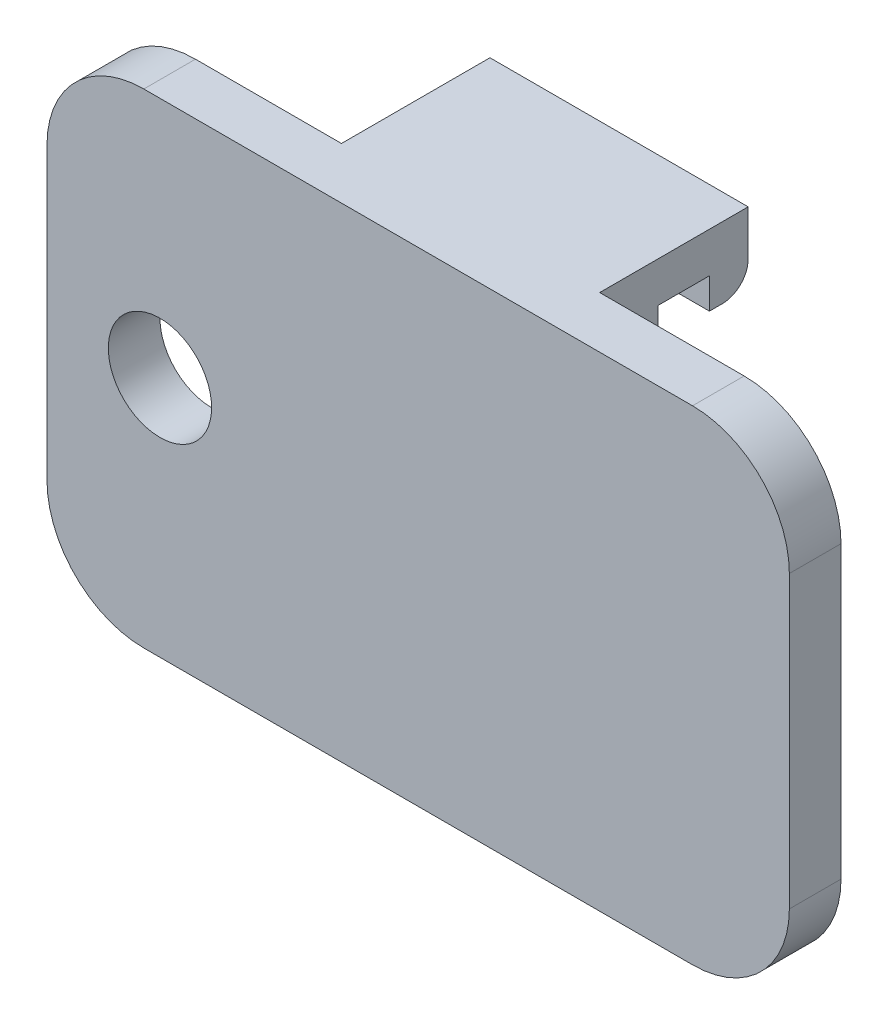
from build123d import *

# Parameters (mm, degrees)
SKETCH_1_W      = 23
SKETCH_1_H      = 15
SKETCH_1_R      = 1.6
EXTRUDE_1_DEPTH = 1.6
SKETCH_2_W      = 8
SKETCH_2_H      = 4
EXTRUDE_2_DEPTH = 1.8
SKETCH_4_W      = 8
SKETCH_4_H      = 1.25
EXTRUDE_3_DEPTH = 1.6
SKETCH_5_W      = 8
SKETCH_5_H      = 2.2
EXTRUDE_4_DEPTH = 1.2
FILLET_1_R      = 0.8
FILLET_2_R      = 3


with BuildPart() as part:
    # 草图1 → 凸台-拉伸1 (new body)
    with BuildSketch(Plane.XY):
        Rectangle(SKETCH_1_W, SKETCH_1_H)
        with Locations((-8, 0)):
            Circle(SKETCH_1_R, mode=Mode.SUBTRACT)
    extrude(amount=EXTRUDE_1_DEPTH)

    # 草图2 → 凸台-拉伸2 (add)
    with BuildSketch(Plane(origin=(0, 0, 0), x_dir=(-1, 0, 0), z_dir=(0, 0, -1))):
        with Locations((-0.023575702, 5.5)):
            Rectangle(SKETCH_2_W, SKETCH_2_H)
        with Locations((-0.023575702, -5.5)):
            Rectangle(SKETCH_2_W, SKETCH_2_H)
    extrude(amount=EXTRUDE_2_DEPTH)

    # 草图4 → 凸台-拉伸3 (add)
    with BuildSketch(Plane(origin=(0, 0, -1.8), x_dir=(-1, 0, 0), z_dir=(0, 0, -1))):
        with Locations((-0.023575702, 6.875)):
            Rectangle(SKETCH_4_W, SKETCH_4_H)
        with Locations((-0.023575702, -6.875)):
            Rectangle(SKETCH_4_W, SKETCH_4_H)
    extrude(amount=EXTRUDE_3_DEPTH)

    # 草图5 → 凸台-拉伸4 (add)
    with BuildSketch(Plane(origin=(0, 0, -3.4), x_dir=(-1, 0, 0), z_dir=(0, 0, -1))):
        with Locations((-0.023575702, 6.4)):
            Rectangle(SKETCH_5_W, SKETCH_5_H)
        with Locations((-0.023575702, -6.4)):
            Rectangle(SKETCH_5_W, SKETCH_5_H)
    extrude(amount=EXTRUDE_4_DEPTH)

    # 圆角1
    fillet_1_edges = [part.edges().sort_by_distance(p)[0] for p in [
        (0.023575702, 5.3, -4.6),
        (0.023575702, -5.3, -4.6),
    ]]
    fillet(fillet_1_edges, radius=FILLET_1_R)

    # 圆角2
    fillet_2_edges = [part.edges().sort_by_distance(p)[0] for p in [
        (-11.5, 7.5, 0.8),
        (11.5, 7.5, 0.8),
        (11.5, -7.5, 0.8),
        (-11.5, -7.5, 0.8),
    ]]
    fillet(fillet_2_edges, radius=FILLET_2_R)


solid = part.part
